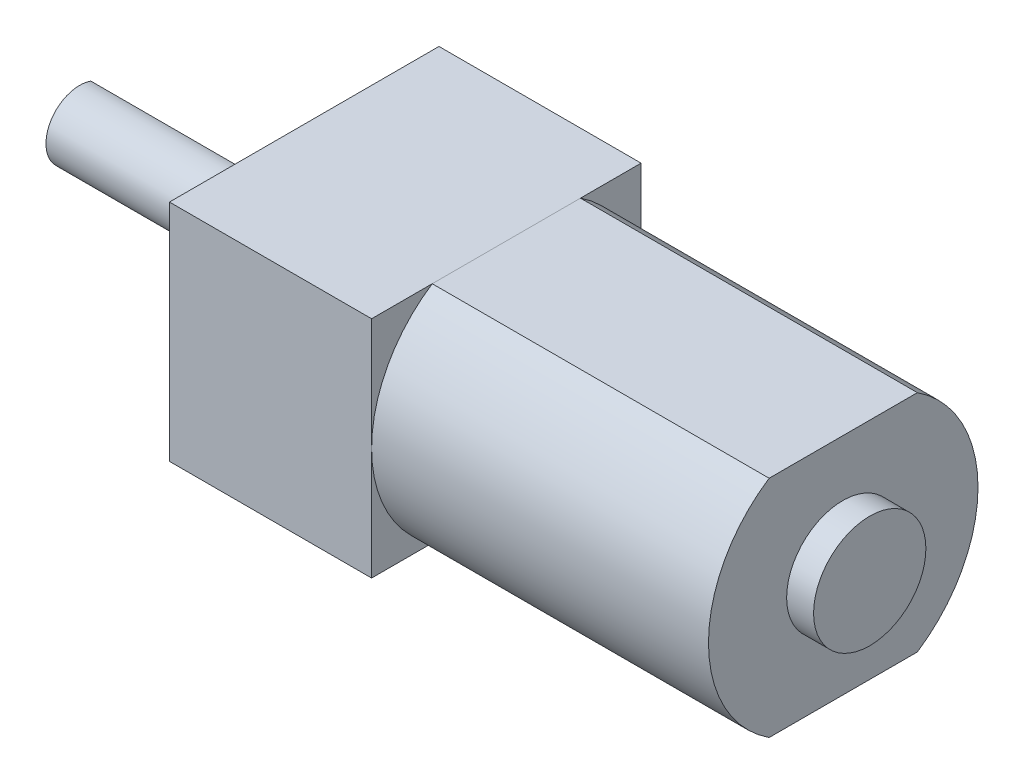
from build123d import *

# Parameters (mm, degrees)
BOSS_EXTRUDE1_DEPTH = 15
SKETCH3_W           = 12
SKETCH3_H           = 10
BOSS_EXTRUDE2_DEPTH = 9
BOSS_EXTRUDE3_DEPTH = 10
SKETCH6_R           = 2.5
BOSS_EXTRUDE4_DEPTH = 1.2


with BuildPart() as part:
    # Sketch1 → Boss-Extrude1 (new body)
    with BuildSketch(Plane(origin=(0, 0, 0), x_dir=(0, 0, -1), z_dir=(1, 0, 0))):
        with BuildLine():
            Line((3.3, 4.070512821), (-3.3, 4.070512821))
            ThreePointArc((-3.3, 4.070512821), (-6, -0.929487179), (-3.3, -5.929487179))
            Line((-3.3, -5.929487179), (3.3, -5.929487179))
            ThreePointArc((3.3, -5.929487179), (6, -0.929487179), (3.3, 4.070512821))
        make_face()
    extrude(amount=BOSS_EXTRUDE1_DEPTH)

    # Sketch6 → Boss-Extrude4 (add)
    with BuildSketch(Plane(origin=(15, 0, 0), x_dir=(0, 0, -1), z_dir=(1, 0, 0))):
        with Locations(Location((-0.02037037, -0.929487179, 0), (0, 0, 180))):
            Circle(SKETCH6_R)
    extrude(amount=BOSS_EXTRUDE4_DEPTH)


with BuildPart() as body_2:
    # Sketch3 → Boss-Extrude2 (new body)
    with BuildSketch(Plane.ZY):
        with Locations((0, -0.929487179)):
            Rectangle(SKETCH3_W, SKETCH3_H)
    extrude(amount=BOSS_EXTRUDE2_DEPTH)


with BuildPart() as body_3:
    # Sketch4 → Boss-Extrude3 (new body)
    with BuildSketch(Plane.ZY.offset(9)):
        with BuildLine():
            Line((-0.5, -2.343700742), (-0.5, 0.484726383))
            ThreePointArc((-0.5, 0.484726383), (1.5, -0.929487179), (-0.5, -2.343700742))
        make_face()
    extrude(amount=BOSS_EXTRUDE3_DEPTH)


solid = Compound([part.part, body_2.part, body_3.part])
